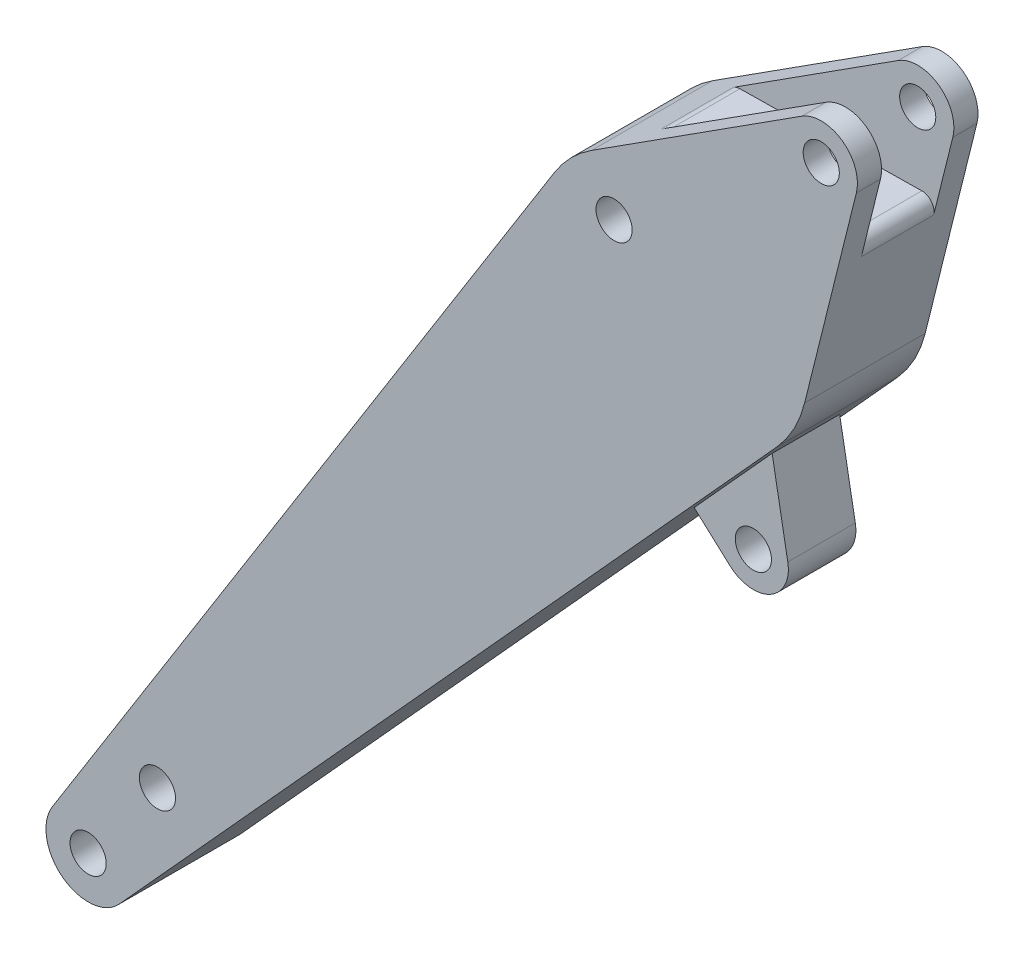
from build123d import *

# Parameters (mm, degrees)
EXTRUDE_1_DEPTH          = 5
EXTRUDE_1_DEPTH_BACK     = 5
SKETCH_1_R               = 1.5
CUT_EXTRUDE_1_DEPTH      = 3
CUT_EXTRUDE_1_DEPTH_BACK = 3
SKETCH_2_R               = 1.5
EXTRUDE_4_DEPTH          = 2.8
EXTRUDE_4_DEPTH_BACK     = 2.8
SKETCH_3_R               = 1.5
FILLET_1_R               = 10
FILLET_2_R               = 1
SCALE1_SCALE             = 1.5


with BuildPart() as part:
    # 草图1 → 凸台-拉伸1 (new, two sides: drawn at the far end of the back side and taken through both)
    with BuildSketch(Plane.XY.offset(-EXTRUDE_1_DEPTH_BACK)):
        with BuildLine():
            Line((255.314096956, 96.605744176), (199.091935004, 34.648006604))
            ThreePointArc((199.091935004, 34.648006604), (194.385791324, 34.210713053), (193.535103741, 38.859943595))
            Line((193.535103741, 38.859943595), (236.376857538, 107.153065983))
            Line((236.376857538, 107.153065983), (255.681175992, 119.525749162))
            ThreePointArc((255.681175992, 119.525749162), (259.048997407, 119.43741832), (260.211134207, 116.275225808))
            Line((260.211134207, 116.275225808), (255.314096956, 96.605744176))
        make_face()
        with Locations((196.5, 37)):
            Circle(SKETCH_1_R, mode=Mode.SUBTRACT)
        with Locations((202.248291042, 44.563540844)):
            Circle(SKETCH_1_R, mode=Mode.SUBTRACT)
        with Locations((257.3, 117)):
            Circle(SKETCH_1_R, mode=Mode.SUBTRACT)
        with Locations((240.118819851, 104.309174626)):
            Circle(SKETCH_1_R, mode=Mode.SUBTRACT)
    extrude(amount=EXTRUDE_1_DEPTH + EXTRUDE_1_DEPTH_BACK)

    # 草图2 → 切除-拉伸1 (cut, two sides: drawn at the far end of the back side and taken through both)
    with BuildSketch(Plane.XY.offset(-CUT_EXTRUDE_1_DEPTH_BACK)):
        with BuildLine():
            Line((255.681175992, 119.525749162), (242.27027225, 110.930322002))
            Line((242.27027225, 110.930322002), (258.937967915, 111.161415211))
            Line((258.937967915, 111.161415211), (260.211134207, 116.275225808))
            ThreePointArc((260.211134207, 116.275225808), (259.048997407, 119.43741832), (255.681175992, 119.525749162))
        make_face()
        with Locations((257.3, 117)):
            Circle(SKETCH_2_R, mode=Mode.SUBTRACT)
    extrude(amount=CUT_EXTRUDE_1_DEPTH + CUT_EXTRUDE_1_DEPTH_BACK, mode=Mode.SUBTRACT)

    # 草图3 → 凸台-拉伸4 (add, two sides: drawn at the far end of the back side and taken through both)
    with BuildSketch(Plane.XY.offset(-EXTRUDE_4_DEPTH_BACK)):
        with BuildLine():
            Line((244.560105761, 84.754670841), (247.522317194, 82.066678389))
            ThreePointArc((247.522317194, 82.066678389), (250.878196788, 81.678515203), (252.324623716, 84.731456021))
            Line((252.324623716, 84.731456021), (251.028481638, 91.882926341))
            Line((251.028481638, 91.882926341), (244.560105761, 84.754670841))
        make_face()
        with Locations((249.471111722, 84.214281678)):
            Circle(SKETCH_3_R, mode=Mode.SUBTRACT)
    extrude(amount=EXTRUDE_4_DEPTH + EXTRUDE_4_DEPTH_BACK)

    # 圆角1
    fillet_1_edges = [part.edges().sort_by_distance(p)[0] for p in [
        (255.314096956, 96.605744176, 0),
        (236.376857538, 107.153065983, 0),
    ]]
    fillet(fillet_1_edges, radius=FILLET_1_R)

    # 圆角2
    fillet_2_edges = [part.edges().sort_by_distance(p)[0] for p in [
        (258.937967915, 111.161415211, 0),
        (242.27027225, 110.930322002, 0),
    ]]
    fillet(fillet_2_edges, radius=FILLET_2_R)


with BuildPart() as part_1:
    # Scale1: scaled about (229.397572443, 79.796058166, 0)
    add(part.part.scale(SCALE1_SCALE).moved(Location((-114.698786222, -39.898029083, 0))))


solid = part_1.part
